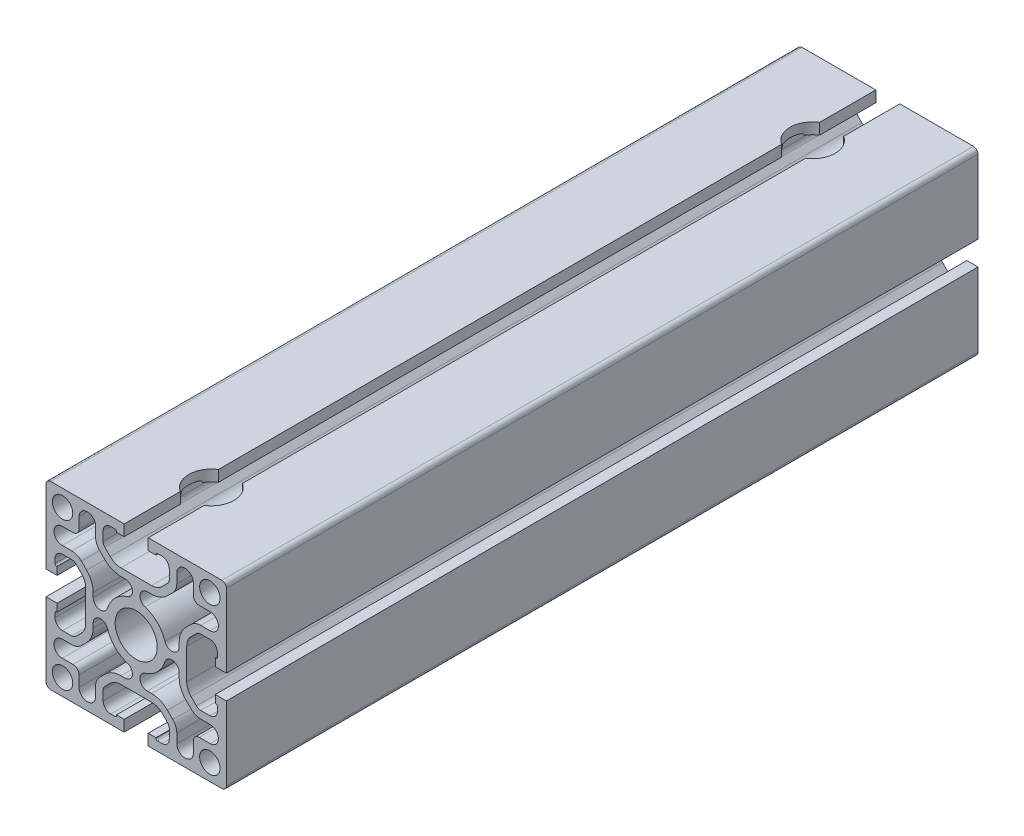
from build123d import *

# Parameters (mm, degrees)
SKETCH1_R               = 3.4
SKETCH1_R_2             = 7
BOSS_EXTRUDE1_DEPTH     = 250
CUT_EXTRUDE1_DEPTH      = 254.574446662
CUT_EXTRUDE1_DEPTH_BACK = 254.574446662
SKETCH2_R               = 7.5


with BuildPart() as part:
    # Sketch1 → Boss-Extrude1 (new body)
    with BuildSketch(Plane(origin=(0, 0, 0), x_dir=(-1, 0, 0), z_dir=(0, 0, -1))):
        with BuildLine():
            Line((5.1, 16.8), (-5.11, 16.8))
            ThreePointArc((-5.11, 16.8), (-7.023417162, 17.180602337), (-8.645533906, 18.264466094))
            Line((-8.645533906, 18.264466094), (-10.42, 20.04))
            ThreePointArc((-10.42, 20.04), (-10.849063493, 20.687796578), (-11, 21.45))
            Line((-11, 21.45), (-11, 24.5))
            ThreePointArc((-11, 24.5), (-10.267766953, 26.267766953), (-8.5, 27))
            Line((-8.5, 27), (-7.07, 27))
            ThreePointArc((-7.07, 27), (-6.716446609, 26.853553391), (-6.57, 26.5))
            Line((-6.57, 26.5), (-6.57, 26.3))
            Line((-6.57, 26.3), (-4, 26.3))
            Line((-4, 26.3), (-4, 30))
            Line((-4, 30), (-28.5, 30))
            ThreePointArc((-28.5, 30), (-29.560660172, 29.560660172), (-30, 28.5))
            Line((-30, 28.5), (-30, 4))
            Line((-30, 4), (-26.3, 4))
            Line((-26.3, 4), (-26.3, 6.57))
            Line((-26.3, 6.57), (-26.500000003, 6.57))
            ThreePointArc((-26.500000003, 6.57), (-26.853553391, 6.716446609), (-27, 7.069999997))
            Line((-27, 7.069999997), (-27, 8.500000474))
            ThreePointArc((-27, 8.500000474), (-26.267767092, 10.267767092), (-24.500000474, 11))
            Line((-24.500000474, 11), (-21.45, 11))
            ThreePointArc((-21.45, 11), (-20.684633135, 10.847759065), (-20.035786438, 10.414213562))
            Line((-20.035786438, 10.414213562), (-18.27, 8.65))
            ThreePointArc((-18.27, 8.65), (-17.181928688, 7.026614358), (-16.8, 5.11))
            Line((-16.8, 5.11), (-16.8, -5.1))
            ThreePointArc((-16.8, -5.1), (-17.180602337, -7.013417162), (-18.264466094, -8.635533906))
            Line((-18.264466094, -8.635533906), (-20.04, -10.41))
            ThreePointArc((-20.04, -10.41), (-20.685169913, -10.847983768), (-21.45, -11))
            Line((-21.45, -11), (-24.5, -11))
            ThreePointArc((-24.5, -11), (-26.267766953, -10.267766953), (-27, -8.5))
            Line((-27, -8.5), (-27, -7.07))
            ThreePointArc((-27, -7.07), (-26.853553391, -6.716446609), (-26.5, -6.57))
            Line((-26.5, -6.57), (-26.3, -6.57))
            Line((-26.3, -6.57), (-26.3, -4))
            Line((-26.3, -4), (-30, -4))
            Line((-30, -4), (-30, -28.5))
            ThreePointArc((-30, -28.5), (-29.560660172, -29.560660172), (-28.5, -30))
            Line((-28.5, -30), (-4, -30))
            Line((-4, -30), (-4, -26.3))
            Line((-4, -26.3), (-6.57, -26.3))
            Line((-6.57, -26.3), (-6.57, -26.5))
            ThreePointArc((-6.57, -26.5), (-6.716446609, -26.853553391), (-7.07, -27))
            Line((-7.07, -27), (-8.5, -27))
            ThreePointArc((-8.5, -27), (-10.267766953, -26.267766953), (-11, -24.5))
            Line((-11, -24.5), (-11, -21.45))
            ThreePointArc((-11, -21.45), (-10.847759065, -20.684633135), (-10.414213562, -20.035786438))
            Line((-10.414213562, -20.035786438), (-8.65, -18.26))
            ThreePointArc((-8.65, -18.26), (-7.024002341, -17.180843639), (-5.11, -16.8))
            Line((-5.11, -16.8), (5.1, -16.8))
            ThreePointArc((5.1, -16.8), (7.014002341, -17.180843639), (8.64, -18.26))
            Line((8.64, -18.26), (10.41, -20.03))
            ThreePointArc((10.41, -20.03), (10.846363066, -20.681264642), (11, -21.45))
            Line((11, -21.45), (11, -24.5))
            ThreePointArc((11, -24.5), (10.267766953, -26.267766953), (8.5, -27))
            Line((8.5, -27), (7.07, -27))
            ThreePointArc((7.07, -27), (6.716446609, -26.853553391), (6.57, -26.5))
            Line((6.57, -26.5), (6.57, -26.3))
            Line((6.57, -26.3), (4, -26.3))
            Line((4, -26.3), (4, -30))
            Line((4, -30), (28.5, -30))
            ThreePointArc((28.5, -30), (29.560660172, -29.560660172), (30, -28.5))
            Line((30, -28.5), (30, -4))
            Line((30, -4), (26.3, -4))
            Line((26.3, -4), (26.3, -6.57))
            Line((26.3, -6.57), (26.5, -6.57))
            ThreePointArc((26.5, -6.57), (26.853553391, -6.716446609), (27, -7.07))
            Line((27, -7.07), (27, -8.5))
            ThreePointArc((27, -8.5), (26.267766953, -10.267766953), (24.5, -11))
            Line((24.5, -11), (21.45, -11))
            ThreePointArc((21.45, -11), (20.684633135, -10.847759065), (20.035786438, -10.414213562))
            Line((20.035786438, -10.414213562), (18.26, -8.64))
            ThreePointArc((18.26, -8.64), (17.180843639, -7.014002341), (16.8, -5.1))
            Line((16.8, -5.1), (16.8, 5.11))
            ThreePointArc((16.8, 5.11), (17.180843639, 7.024002341), (18.26, 8.65))
            Line((18.26, 8.65), (20.035786438, 10.414213562))
            ThreePointArc((20.035786438, 10.414213562), (20.684633135, 10.847759065), (21.45, 11))
            Line((21.45, 11), (24.5, 11))
            ThreePointArc((24.5, 11), (26.267766953, 10.267766953), (27, 8.5))
            Line((27, 8.5), (27, 7.07))
            ThreePointArc((27, 7.07), (26.853553391, 6.716446609), (26.5, 6.57))
            Line((26.5, 6.57), (26.3, 6.57))
            Line((26.3, 6.57), (26.3, 4))
            Line((26.3, 4), (30, 4))
            Line((30, 4), (30, 28.5))
            ThreePointArc((30, 28.5), (29.560660172, 29.560660172), (28.5, 30))
            Line((28.5, 30), (4, 30))
            Line((4, 30), (4, 26.3))
            Line((4, 26.3), (6.57, 26.3))
            Line((6.57, 26.3), (6.57, 26.5))
            ThreePointArc((6.57, 26.5), (6.71641961, 26.85358039), (7.07, 27))
            Line((7.07, 27), (8.5, 27))
            ThreePointArc((8.5, 27), (10.267766953, 26.267766953), (11, 24.5))
            Line((11, 24.5), (11, 21.45))
            ThreePointArc((11, 21.45), (10.847759065, 20.684633135), (10.414213562, 20.035786438))
            Line((10.414213562, 20.035786438), (8.64, 18.27))
            ThreePointArc((8.64, 18.27), (7.016614358, 17.181928688), (5.1, 16.8))
        make_face()
        with Locations(Location((-24.5, 24.5, 0), (0, 0, 180))):
            Circle(SKETCH1_R, mode=Mode.SUBTRACT)
        with Locations(Location((24.5, 24.5, 0), (0, 0, 180))):
            Circle(SKETCH1_R, mode=Mode.SUBTRACT)
        with Locations(Location((-24.5, -24.49, 0), (0, 0, 180))):
            Circle(SKETCH1_R, mode=Mode.SUBTRACT)
        with Locations(Location((24.5, -24.49, 0), (0, 0, 180))):
            Circle(SKETCH1_R, mode=Mode.SUBTRACT)
        with Locations(Location((0, 0, 0), (0, 0, 180))):
            Circle(SKETCH1_R_2, mode=Mode.SUBTRACT)
        with BuildLine():
            Line((5.103398282, -14.3), (3.678409373, -14.3))
            ThreePointArc((3.678409373, -14.3), (1.27735351, -12.23505015), (2.959678316, -9.551979076))
            ThreePointArc((2.959678316, -9.551979076), (7.071067812, -7.071067812), (9.551979076, -2.959678316))
            ThreePointArc((9.551979076, -2.959678316), (12.23505015, -1.27735351), (14.3, -3.678409373))
            Line((14.3, -3.678409373), (14.3, -5.11339393))
            ThreePointArc((14.3, -5.11339393), (14.86686796, -7.973757565), (16.481781365, -10.401734932))
            Line((16.481781365, -10.401734932), (18.243100081, -12.173004601))
            ThreePointArc((18.243100081, -12.173004601), (19.706101967, -13.155028322), (21.434031262, -13.5))
            Line((21.434031262, -13.5), (24.6, -13.5))
            ThreePointArc((24.6, -13.5), (27.35, -16.25), (24.6, -19))
            Line((24.6, -19), (21, -19))
            ThreePointArc((21, -19), (19.585786438, -19.585786438), (19, -21))
            Line((19, -21), (19, -24.6))
            ThreePointArc((19, -24.6), (16.25, -27.35), (13.5, -24.6))
            Line((13.5, -24.6), (13.5, -21.453961031))
            ThreePointArc((13.5, -21.453961031), (13.157457896, -19.731885585), (12.181980515, -18.271980515))
            Line((12.181980515, -18.271980515), (10.406699141, -16.496699141))
            ThreePointArc((10.406699141, -16.496699141), (7.973524025, -14.870903506), (5.103398282, -14.3))
        make_face(mode=Mode.SUBTRACT)
        with BuildLine():
            Line((-3.678409373, -14.3), (-5.103398282, -14.3))
            ThreePointArc((-5.103398282, -14.3), (-7.973524025, -14.870903506), (-10.406699141, -16.496699141))
            Line((-10.406699141, -16.496699141), (-12.181980515, -18.271980515))
            ThreePointArc((-12.181980515, -18.271980515), (-13.157457896, -19.731885585), (-13.5, -21.453961031))
            Line((-13.5, -21.453961031), (-13.5, -24.6))
            ThreePointArc((-13.5, -24.6), (-16.25, -27.35), (-19, -24.6))
            Line((-19, -24.6), (-19, -21))
            ThreePointArc((-19, -21), (-19.585786438, -19.585786438), (-21, -19))
            Line((-21, -19), (-24.6, -19))
            ThreePointArc((-24.6, -19), (-27.35, -16.25), (-24.6, -13.5))
            Line((-24.6, -13.5), (-21.434031262, -13.5))
            ThreePointArc((-21.434031262, -13.5), (-19.706101967, -13.155028322), (-18.243100081, -12.173004601))
            Line((-18.243100081, -12.173004601), (-16.481781365, -10.401734932))
            ThreePointArc((-16.481781365, -10.401734932), (-14.86686796, -7.973757565), (-14.3, -5.11339393))
            Line((-14.3, -5.11339393), (-14.3, -3.678409373))
            ThreePointArc((-14.3, -3.678409373), (-12.23505015, -1.27735351), (-9.551979076, -2.959678316))
            ThreePointArc((-9.551979076, -2.959678316), (-7.071067812, -7.071067812), (-2.959678316, -9.551979076))
            ThreePointArc((-2.959678316, -9.551979076), (-1.27735351, -12.23505015), (-3.678409373, -14.3))
        make_face(mode=Mode.SUBTRACT)
        with BuildLine():
            Line((-5.103398282, 14.3), (-3.678409373, 14.3))
            ThreePointArc((-3.678409373, 14.3), (-1.27735351, 12.23505015), (-2.959678316, 9.551979076))
            ThreePointArc((-2.959678316, 9.551979076), (-7.071067812, 7.071067812), (-9.551979076, 2.959678316))
            ThreePointArc((-9.551979076, 2.959678316), (-12.23505015, 1.27735351), (-14.3, 3.678409373))
            Line((-14.3, 3.678409373), (-14.3, 5.11339393))
            ThreePointArc((-14.3, 5.11339393), (-14.86686796, 7.973757565), (-16.481781365, 10.401734932))
            Line((-16.481781365, 10.401734932), (-18.243100081, 12.173004601))
            ThreePointArc((-18.243100081, 12.173004601), (-19.706101967, 13.155028322), (-21.434031262, 13.5))
            Line((-21.434031262, 13.5), (-24.6, 13.5))
            ThreePointArc((-24.6, 13.5), (-27.35, 16.25), (-24.6, 19))
            Line((-24.6, 19), (-21, 19))
            ThreePointArc((-21, 19), (-19.585786438, 19.585786438), (-19, 21))
            Line((-19, 21), (-19, 24.6))
            ThreePointArc((-19, 24.6), (-16.25, 27.35), (-13.5, 24.6))
            Line((-13.5, 24.6), (-13.5, 21.453961031))
            ThreePointArc((-13.5, 21.453961031), (-13.157457896, 19.731885585), (-12.181980515, 18.271980515))
            Line((-12.181980515, 18.271980515), (-10.406699141, 16.496699141))
            ThreePointArc((-10.406699141, 16.496699141), (-7.973524025, 14.870903506), (-5.103398282, 14.3))
        make_face(mode=Mode.SUBTRACT)
        with BuildLine():
            Line((3.678409373, 14.3), (5.103398282, 14.3))
            ThreePointArc((5.103398282, 14.3), (7.973524025, 14.870903506), (10.406699141, 16.496699141))
            Line((10.406699141, 16.496699141), (12.181980515, 18.271980515))
            ThreePointArc((12.181980515, 18.271980515), (13.157457896, 19.731885585), (13.5, 21.453961031))
            Line((13.5, 21.453961031), (13.5, 24.6))
            ThreePointArc((13.5, 24.6), (16.25, 27.35), (19, 24.6))
            Line((19, 24.6), (19, 21))
            ThreePointArc((19, 21), (19.585786438, 19.585786438), (21, 19))
            Line((21, 19), (24.6, 19))
            ThreePointArc((24.6, 19), (27.35, 16.25), (24.6, 13.5))
            Line((24.6, 13.5), (21.434031262, 13.5))
            ThreePointArc((21.434031262, 13.5), (19.706101967, 13.155028322), (18.243100081, 12.173004601))
            Line((18.243100081, 12.173004601), (16.481781365, 10.401734932))
            ThreePointArc((16.481781365, 10.401734932), (14.86686796, 7.973757565), (14.3, 5.11339393))
            Line((14.3, 5.11339393), (14.3, 3.678409373))
            ThreePointArc((14.3, 3.678409373), (12.23505015, 1.27735351), (9.551979076, 2.959678316))
            ThreePointArc((9.551979076, 2.959678316), (7.071067812, 7.071067812), (2.959678316, 9.551979076))
            ThreePointArc((2.959678316, 9.551979076), (1.27735351, 12.23505015), (3.678409373, 14.3))
        make_face(mode=Mode.SUBTRACT)
    extrude(amount=-BOSS_EXTRUDE1_DEPTH)

    # Sketch2 → Cut-Extrude1 (cut, two sides: drawn at the far end of the back side and taken through both)
    with BuildSketch(Plane(origin=(0, 0, 0), x_dir=(1, 0, 0), z_dir=(0, 1, 0)).offset(-CUT_EXTRUDE1_DEPTH_BACK)):
        with Locations(Location((0, -25, 0), (0, 0, 132.843643044))):
            Circle(SKETCH2_R)
        with Locations(Location((0, -225, 0), (0, 0, 132.843643044))):
            Circle(SKETCH2_R)
    extrude(amount=CUT_EXTRUDE1_DEPTH + CUT_EXTRUDE1_DEPTH_BACK, mode=Mode.SUBTRACT)


solid = part.part
